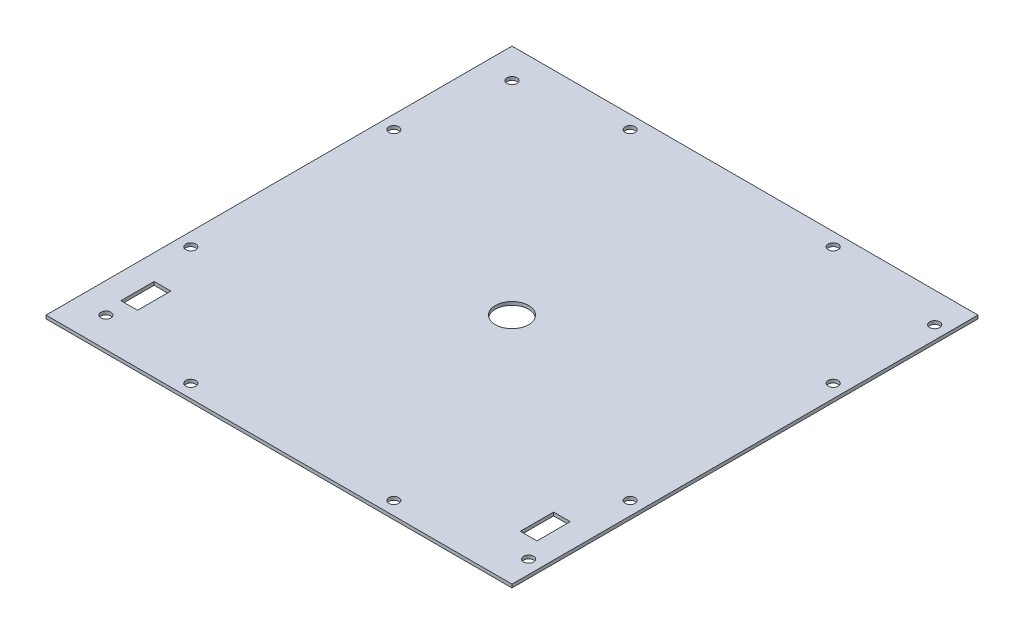
from build123d import *

# Parameters (mm, degrees)
CROQUIS1_W              = 140
CROQUIS1_H              = 140
CROQUIS1_R              = 1.5
CROQUIS1_R_2            = 5
SALIENTE_EXTRUIR1_DEPTH = 1
CROQUIS2_W              = 5
CROQUIS2_H              = 10
CORTAR_EXTRUIR1_DEPTH   = 5


with BuildPart() as part:
    # Croquis1 → Saliente-Extruir1 (new body)
    with BuildSketch(Plane(origin=(0, 0, 0), x_dir=(1, 0, 0), z_dir=(0, 1, 0))):
        Rectangle(CROQUIS1_W, CROQUIS1_H)
        with Locations(Location((-61, 61, 0), (0, 0, 270))):
            Circle(CROQUIS1_R, mode=Mode.SUBTRACT)
        with Locations(Location((66, 61, 0), (0, 0, 270))):
            Circle(CROQUIS1_R, mode=Mode.SUBTRACT)
        with Locations(Location((66, -61, 0), (0, 0, 270))):
            Circle(CROQUIS1_R, mode=Mode.SUBTRACT)
        with Locations(Location((-61, -61, 0), (0, 0, 270))):
            Circle(CROQUIS1_R, mode=Mode.SUBTRACT)
        with Locations(Location((66, 30.5, 0), (0, 0, 270))):
            Circle(CROQUIS1_R, mode=Mode.SUBTRACT)
        with Locations(Location((66, -30.5, 0), (0, 0, 270))):
            Circle(CROQUIS1_R, mode=Mode.SUBTRACT)
        with Locations(Location((-30.5, -66, 0), (0, 0, 270))):
            Circle(CROQUIS1_R, mode=Mode.SUBTRACT)
        with Locations(Location((30.5, -66, 0), (0, 0, 270))):
            Circle(CROQUIS1_R, mode=Mode.SUBTRACT)
        with Locations(Location((-30.5, 66, 0), (0, 0, 90))):
            Circle(CROQUIS1_R, mode=Mode.SUBTRACT)
        with Locations(Location((30.5, 66, 0), (0, 0, 90))):
            Circle(CROQUIS1_R, mode=Mode.SUBTRACT)
        with Locations(Location((-66, 30.5, 0), (0, 0, 90))):
            Circle(CROQUIS1_R, mode=Mode.SUBTRACT)
        with Locations(Location((-66, -30.5, 0), (0, 0, 90))):
            Circle(CROQUIS1_R, mode=Mode.SUBTRACT)
        with Locations(Location((0, 0, 0), (0, 0, 270))):
            Circle(CROQUIS1_R_2, mode=Mode.SUBTRACT)
    extrude(amount=SALIENTE_EXTRUIR1_DEPTH)

    # Croquis2 → Cortar-Extruir1 (cut)
    with BuildSketch(Plane(origin=(0, 1, 0), x_dir=(1, 0, 0), z_dir=(0, 1, 0))):
        with Locations((60, -50)):
            Rectangle(CROQUIS2_W, CROQUIS2_H)
        with Locations((-60, -50)):
            Rectangle(CROQUIS2_W, CROQUIS2_H)
    extrude(amount=-CORTAR_EXTRUIR1_DEPTH, mode=Mode.SUBTRACT)


solid = part.part
